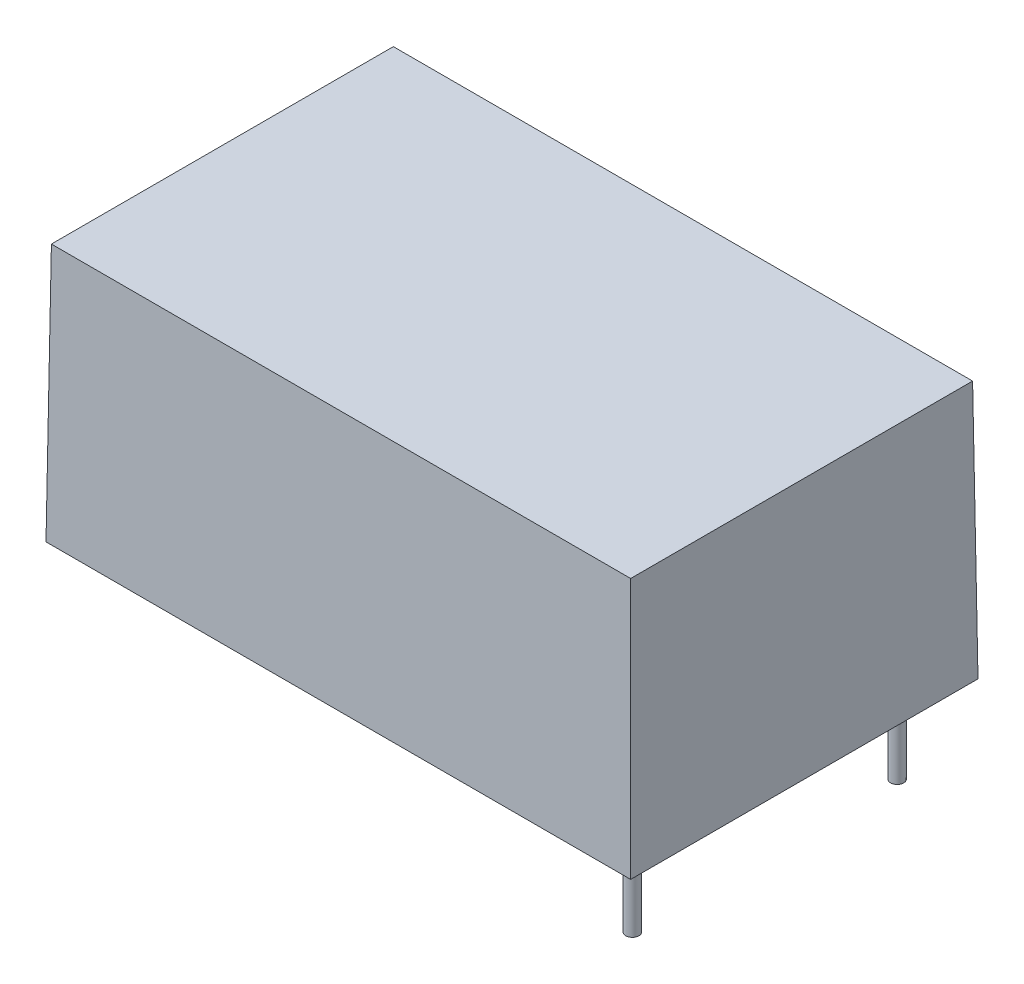
from build123d import *

# Parameters (mm, degrees)
SKETCH1_W           = 34
SKETCH1_H           = 20.2
BOSS_EXTRUDE1_DEPTH = 15
BOSS_EXTRUDE1_TAPER = 0.6
SKETCH2_R           = 0.381
BOSS_EXTRUDE2_DEPTH = 5


with BuildPart() as part:
    # Sketch1 → Boss-Extrude1 (new body)
    with BuildSketch(Plane(origin=(0, 0, 0), x_dir=(1, 0, 0), z_dir=(0, 1, 0))):
        Rectangle(SKETCH1_W, SKETCH1_H)
    extrude(amount=BOSS_EXTRUDE1_DEPTH, taper=BOSS_EXTRUDE1_TAPER)

    # Sketch2 → Boss-Extrude2 (add)
    with BuildSketch(Plane.XZ):
        with Locations(Location((-14.7, 2.5, 0), (0, 0, 90))):
            Circle(SKETCH2_R)
        with Locations(Location((14.7, 7.7, 0), (0, 0, 90))):
            Circle(SKETCH2_R)
        with Locations(Location((14.7, -7.7, 0), (0, 0, 90))):
            Circle(SKETCH2_R)
        with Locations(Location((-14.7, -2.5, 0), (0, 0, 90))):
            Circle(SKETCH2_R)
    extrude(amount=BOSS_EXTRUDE2_DEPTH)


solid = part.part
